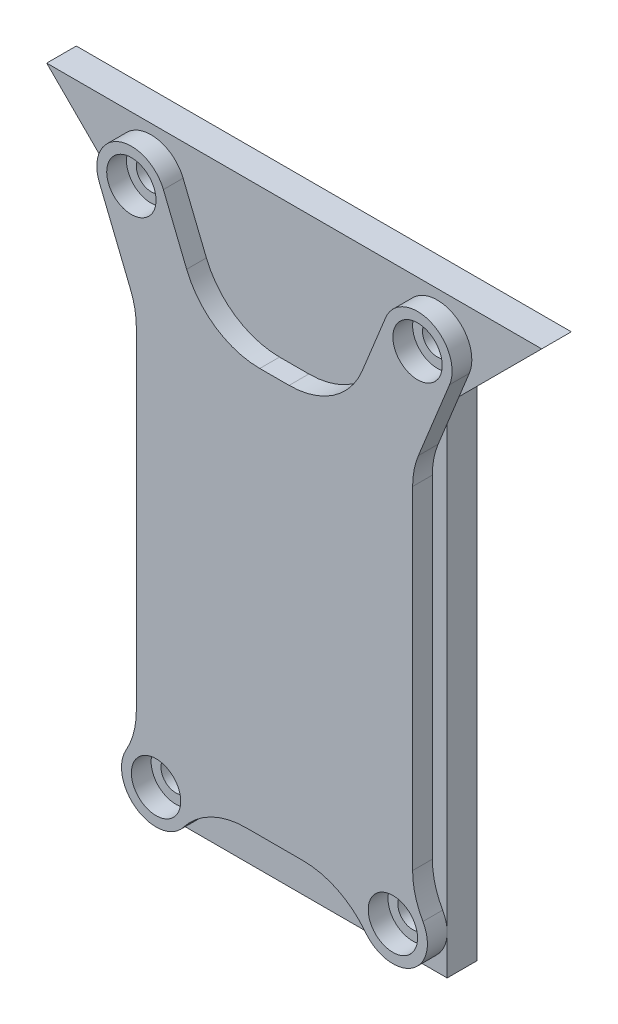
from build123d import *

# Parameters (mm, degrees)
SKETCH1_R           = 1.5
BOSS_EXTRUDE1_DEPTH = 3
SKETCH2_R           = 2.5
BOSS_EXTRUDE2_DEPTH = 2


with BuildPart() as part:
    # Sketch1 → Boss-Extrude1 (new body)
    with BuildSketch(Plane.XY):
        Polygon((0, 0), (31, 0), (31, 50.418881682), (40.581118318, 60), (-9.581118318, 60), (0, 50.418881682), align=None)
        with Locations((30, 55.5)):
            Circle(SKETCH1_R, mode=Mode.SUBTRACT)
        with Locations((27.5, 44)):
            Circle(SKETCH1_R, mode=Mode.SUBTRACT)
        with Locations((27.5, 4)):
            Circle(SKETCH1_R, mode=Mode.SUBTRACT)
        with Locations((3.5, 4)):
            Circle(SKETCH1_R, mode=Mode.SUBTRACT)
        with Locations((3.5, 44)):
            Circle(SKETCH1_R, mode=Mode.SUBTRACT)
        with Locations((1, 55.5)):
            Circle(SKETCH1_R, mode=Mode.SUBTRACT)
    extrude(amount=BOSS_EXTRUDE1_DEPTH)


with BuildPart() as body_2:
    # Sketch2 → Boss-Extrude2 (new body)
    with BuildSketch(Plane.XY.offset(3)):
        with BuildLine():
            Line((14.015011123, 46), (16.984988877, 46))
            ThreePointArc((16.984988877, 46), (21.455677143, 47.365774617), (24.39987727, 50.996763393))
            Line((24.39987727, 50.996763393), (26.755986328, 56.813916016))
            ThreePointArc((26.755986328, 56.813916016), (31.313916016, 58.744013672), (33.244013672, 54.186083984))
            Line((33.244013672, 54.186083984), (30.085111607, 46.386862904))
            ThreePointArc((30.085111607, 46.386862904), (29.647640255, 44.913478063), (29.5, 43.383626297))
            Line((29.5, 43.383626297), (29.5, 9.678908346))
            ThreePointArc((29.5, 9.678908346), (29.765267493, 7.635892672), (30.543478261, 5.72836341))
            ThreePointArc((30.543478261, 5.72836341), (29.433997179, 1.082868719), (24.723086671, 1.869565217))
            ThreePointArc((24.723086671, 1.869565217), (21.914463152, 4.17483525), (18.375856205, 5))
            Line((18.375856205, 5), (12.624143795, 5))
            ThreePointArc((12.624143795, 5), (9.085536848, 4.17483525), (6.276913329, 1.869565217))
            ThreePointArc((6.276913329, 1.869565217), (1.566002821, 1.082868719), (0.456521739, 5.72836341))
            ThreePointArc((0.456521739, 5.72836341), (1.234732507, 7.635892672), (1.5, 9.678908346))
            Line((1.5, 9.678908346), (1.5, 43.383626297))
            ThreePointArc((1.5, 43.383626297), (1.352359745, 44.913478063), (0.914888393, 46.386862904))
            Line((0.914888393, 46.386862904), (-2.244013672, 54.186083984))
            ThreePointArc((-2.244013672, 54.186083984), (-0.313916016, 58.744013672), (4.244013672, 56.813916016))
            Line((4.244013672, 56.813916016), (6.60012273, 50.996763393))
            ThreePointArc((6.60012273, 50.996763393), (9.544322857, 47.365774617), (14.015011123, 46))
        make_face()
        with Locations((27.5, 4)):
            Circle(SKETCH2_R, mode=Mode.SUBTRACT)
        with Locations((30, 55.5)):
            Circle(SKETCH2_R, mode=Mode.SUBTRACT)
        with Locations(Location((1, 55.5, 0), (0, 0, 180))):
            Circle(SKETCH2_R, mode=Mode.SUBTRACT)
        with Locations(Location((3.5, 4, 0), (0, 0, 180))):
            Circle(SKETCH2_R, mode=Mode.SUBTRACT)
    extrude(amount=BOSS_EXTRUDE2_DEPTH)


solid = Compound([part.part, body_2.part])
